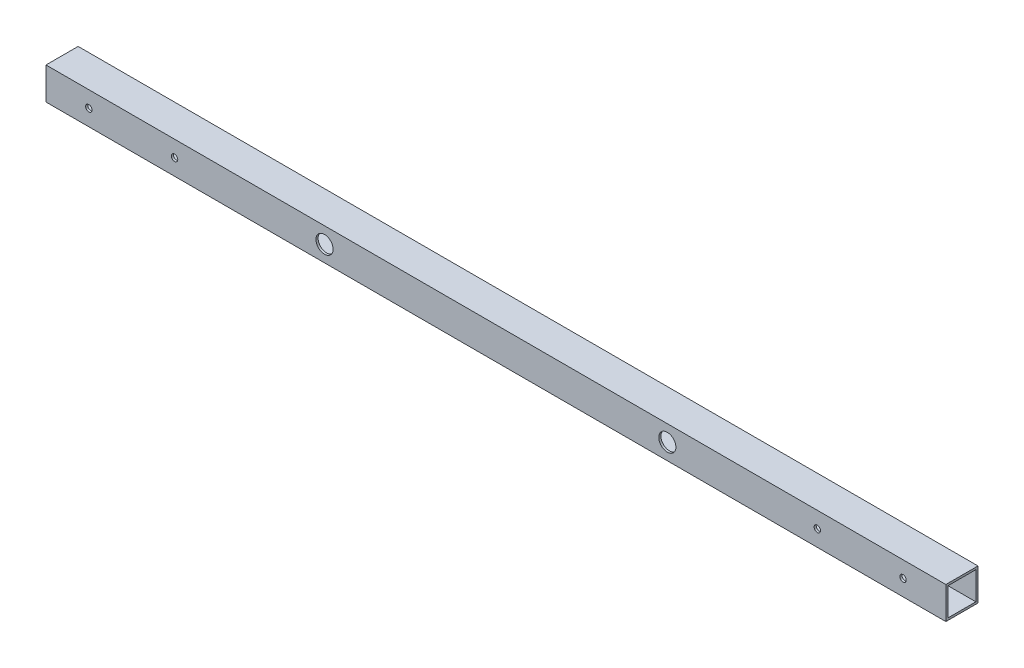
from build123d import *

# Parameters (mm, degrees)
SKETCH_1_W          = 15
SKETCH_1_H          = 15
SKETCH_1_W_2        = 13
SKETCH_1_H_2        = 13
EXTRUDE_1_DEPTH     = 420
SKETCH_2_R          = 1.5
CUT_EXTRUDE_1_DEPTH = 421.334688076
SKETCH_3_R          = 4
CUT_EXTRUDE_2_DEPTH = 10


with BuildPart() as part:
    # 草图1 → 凸台-拉伸1 (new body)
    with BuildSketch(Plane(origin=(0, 0, 0), x_dir=(0, 0, -1), z_dir=(1, 0, 0))):
        Rectangle(SKETCH_1_W, SKETCH_1_H)
        Rectangle(SKETCH_1_W_2, SKETCH_1_H_2, mode=Mode.SUBTRACT)
    extrude(amount=EXTRUDE_1_DEPTH)

    # 草图2 → 切除-拉伸1 (cut, through all)
    with BuildSketch(Plane.XY.offset(7.5)):
        with Locations((20, 0)):
            Circle(SKETCH_2_R)
        with Locations((60, 0)):
            Circle(SKETCH_2_R)
        with Locations((130, 0)):
            Circle(SKETCH_2_R)
        with Locations(Location((290, 0, 0), (0, 0, 270))):
            Circle(SKETCH_2_R)
        with Locations(Location((360, 0, 0), (0, 0, 270))):
            Circle(SKETCH_2_R)
        with Locations(Location((400, 0, 0), (0, 0, 270))):
            Circle(SKETCH_2_R)
    extrude(amount=-CUT_EXTRUDE_1_DEPTH, mode=Mode.SUBTRACT)

    # 草图3 → 切除-拉伸2 (cut)
    with BuildSketch(Plane.XY.offset(7.5)):
        with Locations((130, 0)):
            Circle(SKETCH_3_R)
        with Locations((290, 0)):
            Circle(SKETCH_3_R)
    extrude(amount=-CUT_EXTRUDE_2_DEPTH, mode=Mode.SUBTRACT)


solid = part.part
